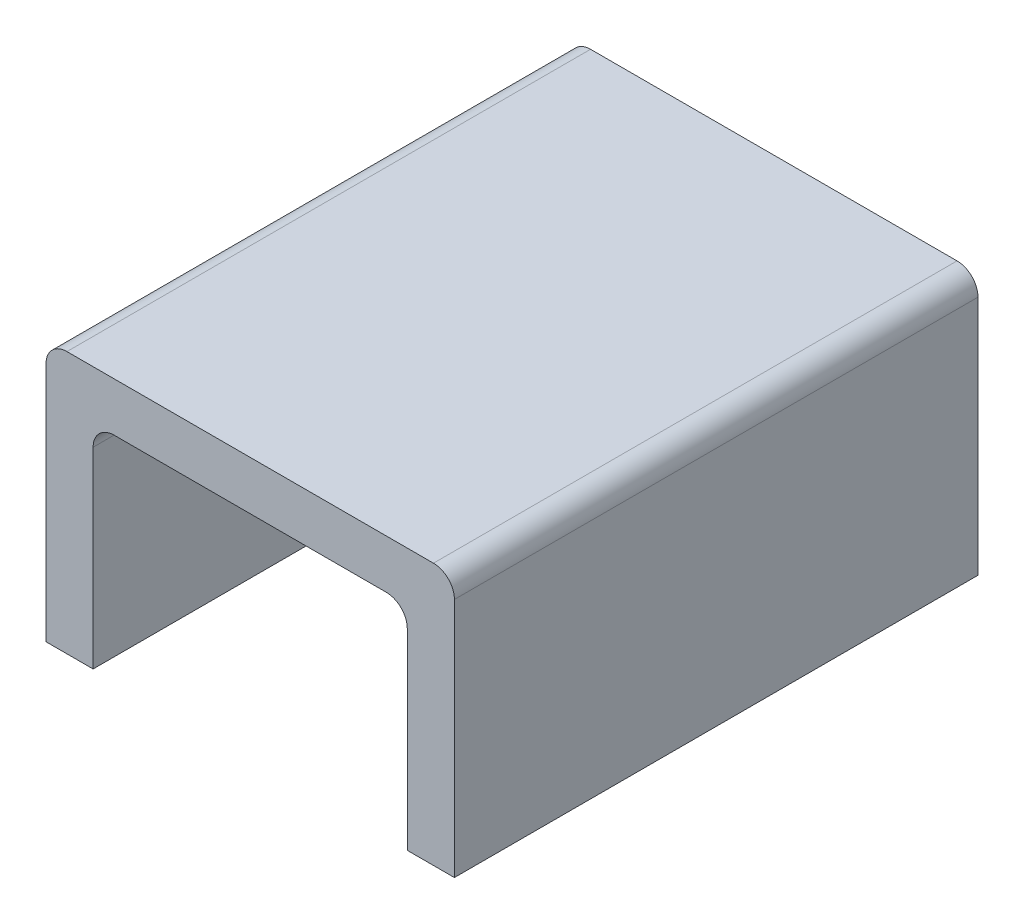
from build123d import *

# Parameters (mm, degrees)
BOSS_EXTRU_1_DEPTH = 50


with BuildPart() as part:
    # Esquisse2 → Boss.-Extru.1 (new body)
    with BuildSketch(Plane.XY):
        with BuildLine():
            Line((-32.625, -8.920454545), (-32.625, 9.079545455))
            ThreePointArc((-32.625, 9.079545455), (-32.039213562, 10.493759017), (-30.625, 11.079545455))
            Line((-30.625, 11.079545455), (4.375, 11.079545455))
            ThreePointArc((4.375, 11.079545455), (5.789213562, 10.493759017), (6.375, 9.079545455))
            Line((6.375, 9.079545455), (6.375, -13.920454545))
            Line((6.375, -13.920454545), (1.875, -13.920454545))
            Line((1.875, -13.920454545), (1.875, 4.420454545))
            ThreePointArc((1.875, 4.420454545), (1.289213562, 5.834668108), (-0.125, 6.420454545))
            Line((-0.125, 6.420454545), (-26.125, 6.420454545))
            ThreePointArc((-26.125, 6.420454545), (-27.539213562, 5.834668108), (-28.125, 4.420454545))
            Line((-28.125, 4.420454545), (-28.125, -13.920454545))
            Line((-28.125, -13.920454545), (-32.625, -13.920454545))
            Line((-32.625, -13.920454545), (-32.625, -8.920454545))
        make_face()
    extrude(amount=BOSS_EXTRU_1_DEPTH)


solid = part.part
